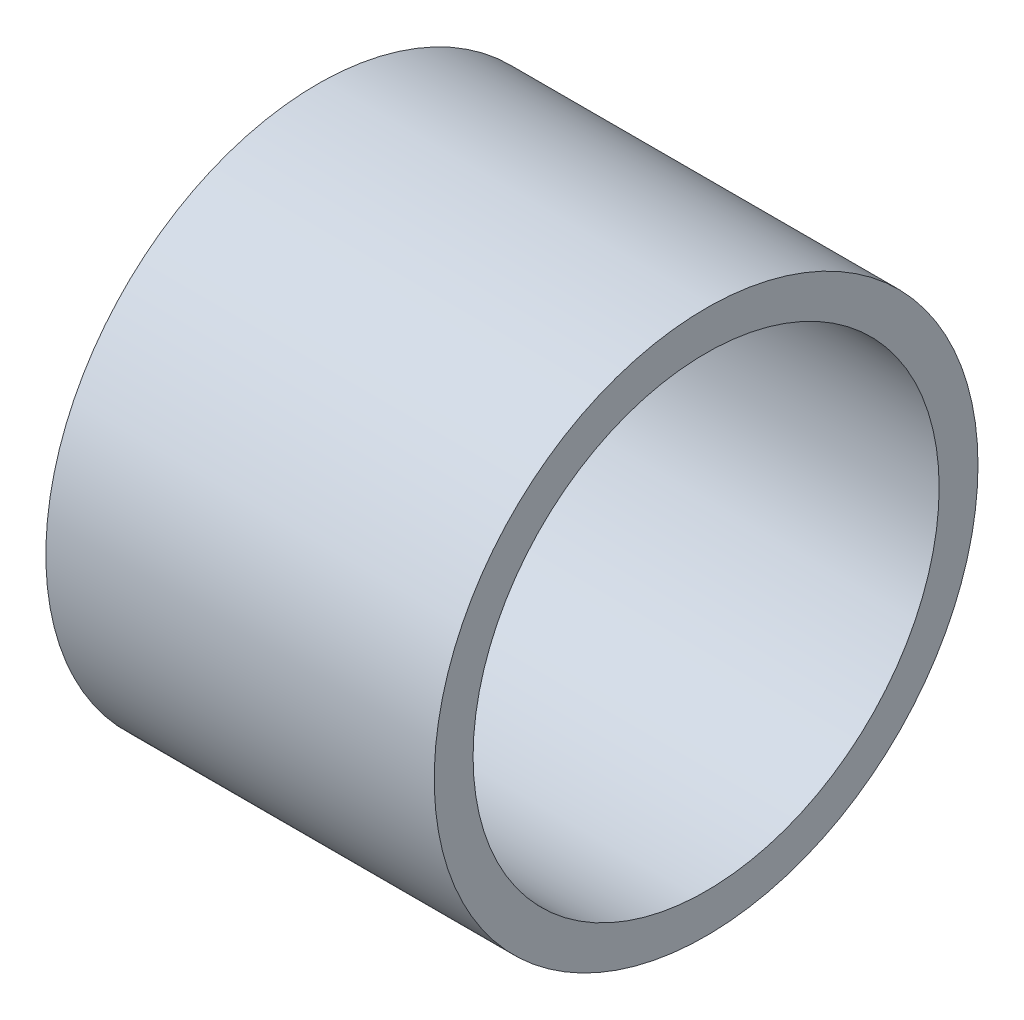
from build123d import *

# Parameters (mm, degrees)
SKETCH1_R           = 3.5
SKETCH1_R_2         = 3
BOSS_EXTRUDE1_DEPTH = 5


with BuildPart() as part:
    # Sketch1 → Boss-Extrude1 (new body)
    with BuildSketch(Plane(origin=(0, 0, 0), x_dir=(0, 0, -1), z_dir=(1, 0, 0))):
        Circle(SKETCH1_R)
        Circle(SKETCH1_R_2, mode=Mode.SUBTRACT)
    extrude(amount=BOSS_EXTRUDE1_DEPTH)


solid = part.part
